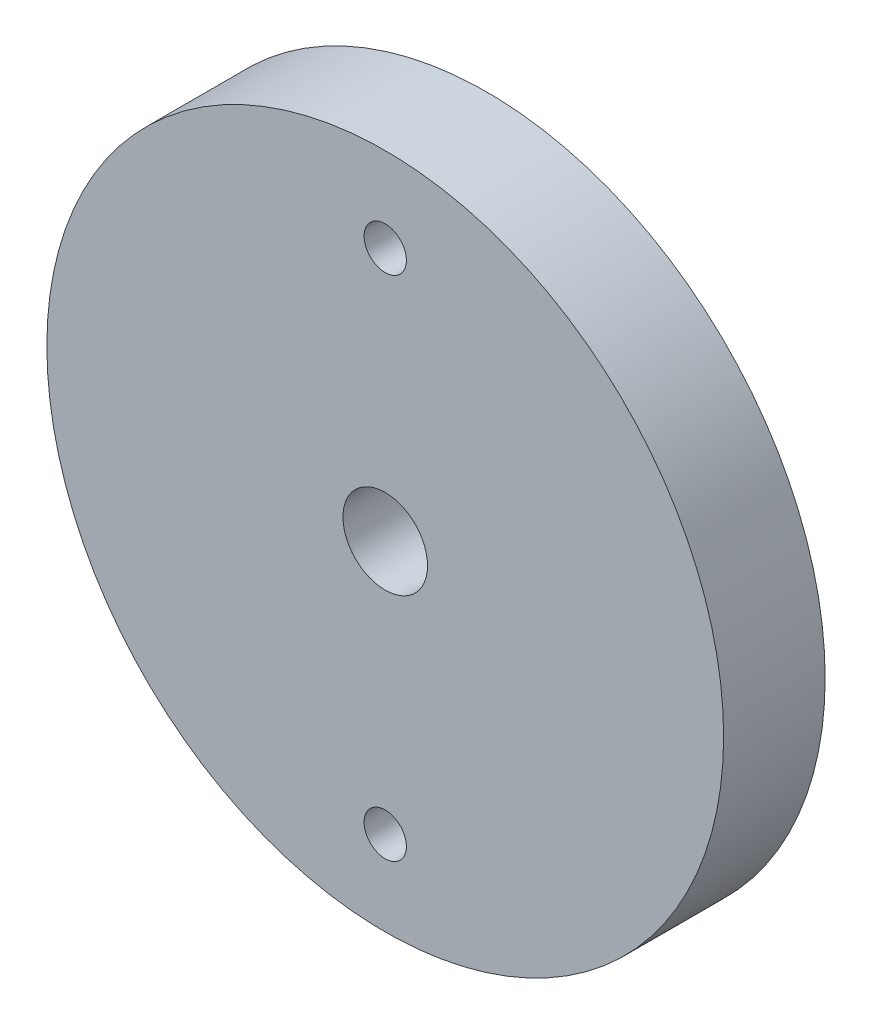
from build123d import *

# Parameters (mm, degrees)
SKETCH_1_R          = 40
EXTRUDE_1_DEPTH     = 12
SKETCH_2_R          = 5
SKETCH_2_R_2        = 2.5
CUT_EXTRUDE_1_DEPTH = 10
SKETCH_3_R          = 4.75
CUT_EXTRUDE_2_DEPTH = 5


with BuildPart() as part:
    # 草图1 → 凸台-拉伸1 (new body)
    with BuildSketch(Plane.XY):
        Circle(SKETCH_1_R)
    extrude(amount=EXTRUDE_1_DEPTH)

    # 草图2 → 切除-拉伸1 (cut)
    with BuildSketch(Plane.XY.offset(12)):
        Circle(SKETCH_2_R)
        with Locations((0, 30)):
            Circle(SKETCH_2_R_2)
        with Locations((0, -30)):
            Circle(SKETCH_2_R_2)
    extrude(amount=-CUT_EXTRUDE_1_DEPTH, mode=Mode.SUBTRACT)

    # 草图3 → 切除-拉伸2 (cut)
    with BuildSketch(Plane(origin=(0, 0, 0), x_dir=(-1, 0, 0), z_dir=(0, 0, -1))):
        with Locations((0, -30)):
            Circle(SKETCH_3_R)
        with Locations((0, 30)):
            Circle(SKETCH_3_R)
    extrude(amount=-CUT_EXTRUDE_2_DEPTH, mode=Mode.SUBTRACT)


solid = part.part
